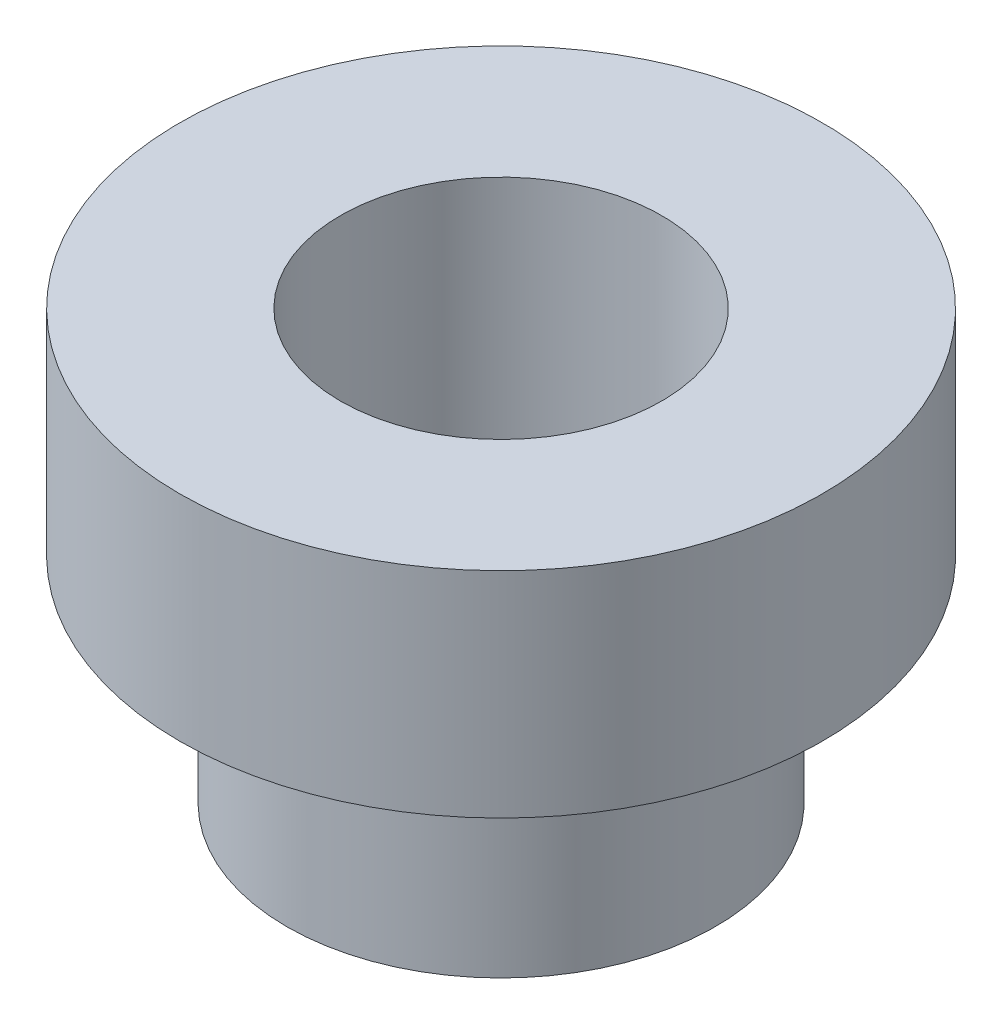
from build123d import *

# Parameters (mm, degrees)
SKETCH2_R           = 2
SKETCH2_R_2         = 1.5
BOSS_EXTRUDE1_DEPTH = 2
SKETCH3_R           = 3
SKETCH3_R_2         = 1.5
BOSS_EXTRUDE2_DEPTH = 2


with BuildPart() as part:
    # Sketch2 → Boss-Extrude1 (new body)
    with BuildSketch(Plane(origin=(0, 0, 0), x_dir=(1, 0, 0), z_dir=(0, 1, 0))):
        with Locations(Location((0, 0, 0), (0, 0, 270))):
            Circle(SKETCH2_R)
        with Locations(Location((0, 0, 0), (0, 0, 270))):
            Circle(SKETCH2_R_2, mode=Mode.SUBTRACT)
    extrude(amount=BOSS_EXTRUDE1_DEPTH)

    # Sketch3 → Boss-Extrude2 (add)
    with BuildSketch(Plane(origin=(0, 2, 0), x_dir=(1, 0, 0), z_dir=(0, 1, 0))):
        with Locations(Location((0, 0, 0), (0, 0, 270))):
            Circle(SKETCH3_R)
        with Locations(Location((0, 0, 0), (0, 0, 270))):
            Circle(SKETCH3_R_2, mode=Mode.SUBTRACT)
    extrude(amount=BOSS_EXTRUDE2_DEPTH)


solid = part.part
